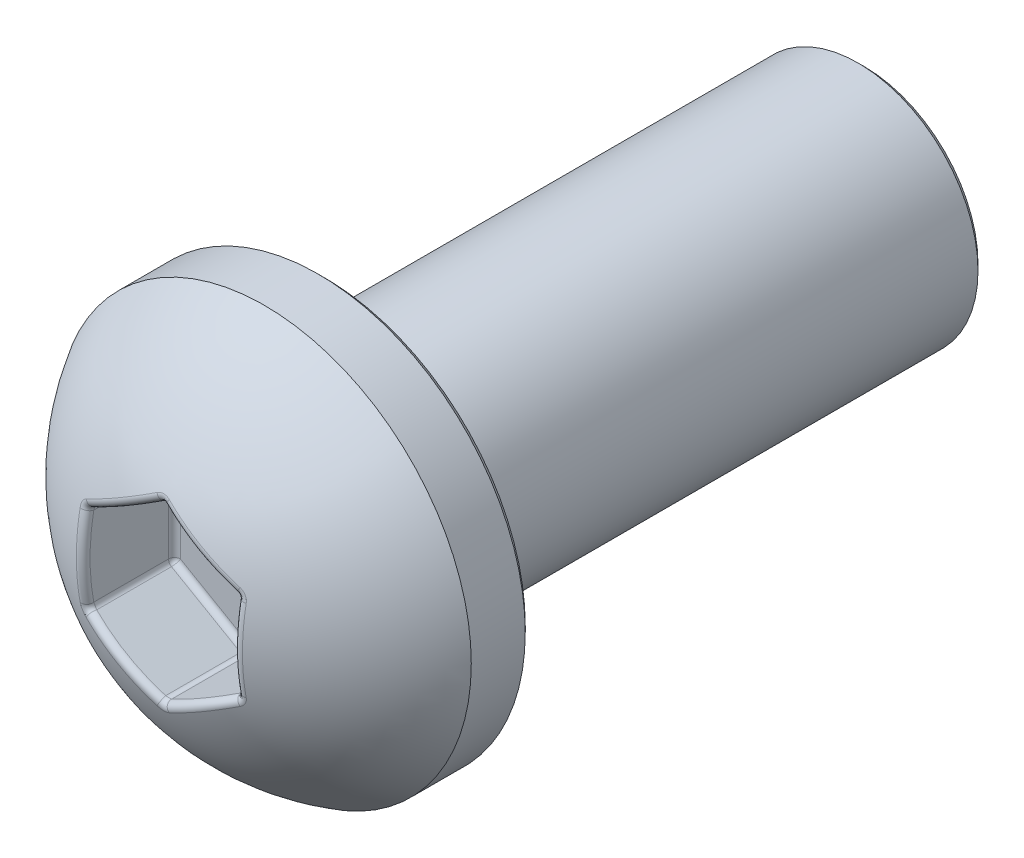
from build123d import *

# Parameters (mm, degrees)
SCHNITT_LINEAR_AUSTRAGEN1_DEPTH = 3.5
FASE1_SIZE                      = 0.2
VERRUNDUNG1_R                   = 0.2


with BuildPart() as part:
    # Skizze1 → Rotation1 (revolve)
    with BuildSketch(Plane(origin=(0, 0, 0), x_dir=(0, 0, -1), z_dir=(1, 0, 0)), mode=Mode.PRIVATE) as rotation1_sk:
        with BuildLine():
            Line((-2, 6.9), (0, 6.9))
            Line((0, 6.9), (0, 4))
            Line((0, 4), (18, 4))
            Line((18, 4), (18, 0))
            Line((18, 0), (-6, 0))
            ThreePointArc((-6, 0), (-4.927694437, 3.987793876), (-2, 6.9))
        make_face()
    revolve(rotation1_sk.sketch.rotate(Axis((0, 0, 21.919879518), (0, 0, -1)), 90), axis=Axis((0, 0, 21.919879518), (0, 0, -1)))

    # Skizze2 → Schnitt-Linear austragen1 (cut)
    with BuildSketch(Plane.XY.offset(6)):
        Polygon((2.5, -1.443375673), (2.5, 1.443375673), (0, 2.886751346), (-2.5, 1.443375673), (-2.5, -1.443375673), (0, -2.886751346), align=None)
    extrude(amount=-SCHNITT_LINEAR_AUSTRAGEN1_DEPTH, mode=Mode.SUBTRACT)

    # Fase1
    fase1_edges = [part.edges().sort_by_distance(p)[0] for p in [
        (-6.9, 0, 0),
        (-4, 0, -18),
    ]]
    chamfer(fase1_edges, length=FASE1_SIZE)

    # Verrundung1
    verrundung1_edges = [part.edges().sort_by_distance(p)[0] for p in [
        (2.5, -0.725040561, 5.561851407),
        (1.25, 2.165063509, 5.596754807),
        (-1.25, 2.165063509, 5.596754807),
        (-2.5, 0, 5.596754807),
        (-1.25, -2.165063509, 5.596754807),
        (1.25, -2.165063509, 5.596754807),
        (2.5, -1.443375673, 3.978732003),
        (1.25, -2.165063509, 2.5),
        (0, -2.886751346, 3.978732003),
        (-1.25, -2.165063509, 2.5),
        (-2.5, -1.443375673, 3.978732003),
        (-2.5, 0, 2.5),
        (-2.5, 1.443375673, 3.978732003),
        (-1.25, 2.165063509, 2.5),
        (0, 2.886751346, 3.978732003),
        (1.25, 2.165063509, 2.5),
        (2.5, 1.443375673, 3.978732003),
        (2.5, 0, 2.5),
        (-4, 0, 0),
    ]]
    fillet(verrundung1_edges, radius=VERRUNDUNG1_R)


solid = part.part
